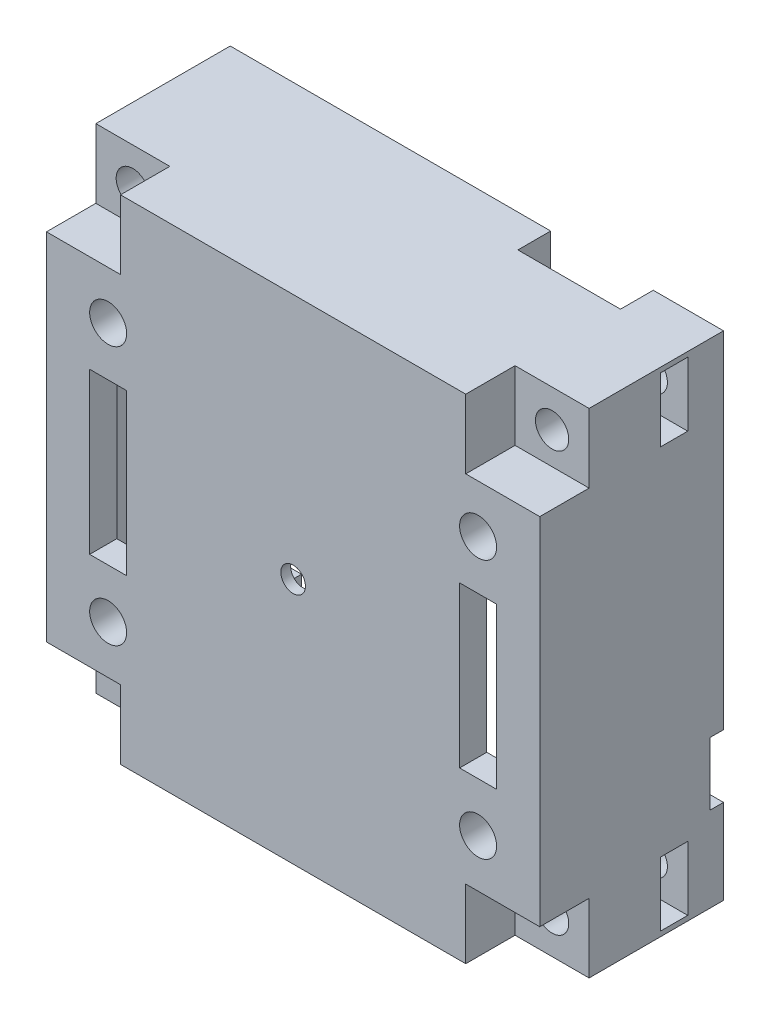
from build123d import *

# Parameters (mm, degrees)
SKETCH_1_W               = 40
SKETCH_1_H               = 40
EXTRUDE_1_DEPTH          = 12.7
CUT_EXTRUDE_2_DEPTH      = 0.7
CUT_EXTRUDE_2_DEPTH_BACK = 1.5
SKETCH_8_W               = 36.4
SKETCH_8_H               = 28.4
CUT_EXTRUDE_4_DEPTH      = 12.7
SKETCH_10_R              = 0.5
SKETCH_10_R_2            = 1.5
SKETCH_10_W              = 3
SKETCH_10_H              = 13
EXTRUDE_2_DEPTH          = 2.2
CUT_EXTRUDE_START        = -12.7
SKETCH_13_R              = 1.35
CUT_EXTRUDE_6_DEPTH      = 12.7
FILLET_1_R               = 1
SKETCH_14_W              = 8.31999735
SKETCH_14_H              = 2.64999918
CUT_EXTRUDE_8_DEPTH      = 5.8
SKETCH_15_W              = 12.8999835
SKETCH_15_H              = 7.3
CUT_EXTRUDE_9_DEPTH      = 5.8
SKETCH_16_W              = 1.085536683
SKETCH_16_H              = 5.100270408
CUT_EXTRUDE_10_DEPTH     = 1.8
SKETCH_17_W              = 8.31999735
SKETCH_17_H              = 2.65925193
CUT_EXTRUDE_11_DEPTH     = 5.8
SKETCH_23_W              = 6.0022214
SKETCH_23_H              = 5.598076211
SKETCH_23_H_2            = 5.598076212
CUT_EXTRUDE_12_DEPTH     = 4
SKETCH_24_W              = 11
SKETCH_24_H              = 14
CUT_EXTRUDE_14_DEPTH     = 1.4
SKETCH_22_W              = 1
SKETCH_22_H              = 0.8


with BuildPart() as part:
    # 草图1 → 凸台-拉伸1 (new body)
    with BuildSketch(Plane(origin=(0, 0, -12.4), x_dir=(-1, 0, 0), z_dir=(0, 0, -1))):
        with Locations((-18.22949197, 11.132690632)):
            Rectangle(SKETCH_1_W, SKETCH_1_H)
    extrude(amount=-EXTRUDE_1_DEPTH)

    # 草图2 → 切除-拉伸2 (cut, two sides: drawn at the far end of the back side and taken through both)
    with BuildSketch(Plane.XY.offset(-8).offset(-CUT_EXTRUDE_2_DEPTH_BACK)):
        Polygon((-2.01828663, -8.469233156), (2.73171337, -8.469233156), (4.23171337, -5.871156945), (2.72949197, -3.269233156), (-2.01828663, -3.269233156), align=None)
        Polygon((-2.01828663, 25.534614421), (-2.01828663, 30.734614421), (2.73171337, 30.734614421), (4.23171337, 28.13653821), (2.72949197, 25.534614421), align=None)
        Polygon((38.47727057, 30.734614421), (33.72727057, 30.734614421), (32.22727057, 28.13653821), (33.72949197, 25.534614421), (38.47727057, 25.534614421), align=None)
        Polygon((38.47727057, -3.269233156), (38.47727057, -8.469233156), (33.72727057, -8.469233156), (32.22727057, -5.871156945), (33.72949197, -3.269233156), align=None)
    extrude(amount=CUT_EXTRUDE_2_DEPTH + CUT_EXTRUDE_2_DEPTH_BACK, mode=Mode.SUBTRACT)

    # 草图8 → 切除-拉伸4 (cut)
    with BuildSketch(Plane(origin=(0, 0, -12.4), x_dir=(-1, 0, 0), z_dir=(0, 0, -1))):
        with Locations((-18.22949197, 11.132690632)):
            Rectangle(SKETCH_8_W, SKETCH_8_H)
    extrude(amount=-CUT_EXTRUDE_4_DEPTH, mode=Mode.SUBTRACT)

    # 草图13 → 切除-拉伸6 (cut)
    with BuildSketch(Plane(origin=(0, 0, -12.4), x_dir=(-1, 0, 0), z_dir=(0, 0, -1)).offset(CUT_EXTRUDE_START)):
        with Locations((-35.22949197, -5.867309368)):
            Circle(SKETCH_13_R)
        with Locations(Location((-1.22949197, -5.867309368, 0), (0, 0, 180))):
            Circle(SKETCH_13_R)
        with Locations((-1.22949197, 28.132690632)):
            Circle(SKETCH_13_R)
        with Locations(Location((-35.22949197, 28.132690632, 0), (0, 0, 180))):
            Circle(SKETCH_13_R)
    extrude(amount=CUT_EXTRUDE_6_DEPTH, mode=Mode.SUBTRACT)

    # 圆角1
    fillet_1_edges = [part.edges().sort_by_distance(p)[0] for p in [
        (0.02949197, 25.332690632, -6.05),
        (0.02949197, -3.067309368, -6.05),
        (36.42949197, -3.067309368, -6.05),
        (36.42949197, 25.332690632, -6.05),
    ]]
    fillet(fillet_1_edges, radius=FILLET_1_R)

    # 草图14 → 切除-拉伸8 (cut)
    with BuildSketch(Plane.XZ.offset(8.867309368)):
        with Locations((8.169941285, -11.07500041)):
            Rectangle(SKETCH_14_W, SKETCH_14_H)
    extrude(amount=-CUT_EXTRUDE_8_DEPTH, mode=Mode.SUBTRACT)

    # 草图15 → 切除-拉伸9 (cut)
    with BuildSketch(Plane.XZ.offset(8.867309368)):
        with Locations((23.79587104, -8.75)):
            Rectangle(SKETCH_15_W, SKETCH_15_H)
    extrude(amount=-CUT_EXTRUDE_9_DEPTH, mode=Mode.SUBTRACT)

    # 草图16 → 切除-拉伸10 (cut)
    with BuildSketch(Plane(origin=(38.22949197, 0, 0), x_dir=(0, 0, -1), z_dir=(1, 0, 0))):
        with Locations((11.857231659, 0.566559812)):
            Rectangle(SKETCH_16_W, SKETCH_16_H)
    extrude(amount=-CUT_EXTRUDE_10_DEPTH, mode=Mode.SUBTRACT)

    # 草图17 → 切除-拉伸11 (cut)
    with BuildSketch(Plane(origin=(0, 31.132690632, 0), x_dir=(1, 0, 0), z_dir=(0, 1, 0))):
        with Locations((28.372981895, 11.070374035)):
            Rectangle(SKETCH_17_W, SKETCH_17_H)
    extrude(amount=-CUT_EXTRUDE_11_DEPTH, mode=Mode.SUBTRACT)

    # 草图23 → 切除-拉伸12 (cut)
    with BuildSketch(Plane.XY.offset(2.5)):
        with Locations((35.22838127, 28.333652527)):
            Rectangle(SKETCH_23_W, SKETCH_23_H)
        with Locations((35.22838127, -6.068271262)):
            Rectangle(SKETCH_23_W, SKETCH_23_H_2)
        with Locations((1.23060267, -6.068271262)):
            Rectangle(SKETCH_23_W, SKETCH_23_H_2)
        with Locations((1.23060267, 28.333652527)):
            Rectangle(SKETCH_23_W, SKETCH_23_H)
    extrude(amount=-CUT_EXTRUDE_12_DEPTH, mode=Mode.SUBTRACT)


with BuildPart() as body_2:
    # 草图10 → 凸台-拉伸2 (new body)
    with BuildSketch(Plane.XY.offset(0.3)):
        Polygon((-1.77050803, 25.534614421), (4.23171337, 25.534614421), (4.23171337, 31.132690632), (32.22727057, 31.132690632), (32.22727057, 25.534614421), (38.22949197, 25.534614421), (38.22949197, -3.269233156), (32.22727057, -3.269233156), (32.22727057, -8.867309368), (4.23171337, -8.867309368), (4.23171337, -3.269233156), (-1.77050803, -3.269233156), align=None)
        with Locations((18.22949197, 11.132690632)):
            Circle(SKETCH_10_R, mode=Mode.SUBTRACT)
        with Locations((3.22949197, 0.632690632)):
            Circle(SKETCH_10_R_2, mode=Mode.SUBTRACT)
        with Locations((3.22949197, 21.632690632)):
            Circle(SKETCH_10_R_2, mode=Mode.SUBTRACT)
        with Locations(Location((33.22949197, 21.632690632, 0), (0, 0, 180))):
            Circle(SKETCH_10_R_2, mode=Mode.SUBTRACT)
        with Locations(Location((33.22949197, 0.632690632, 0), (0, 0, 180))):
            Circle(SKETCH_10_R_2, mode=Mode.SUBTRACT)
        with Locations((3.22949197, 11.132690632)):
            Rectangle(SKETCH_10_W, SKETCH_10_H, mode=Mode.SUBTRACT)
        with Locations((33.22949197, 11.132690632)):
            Rectangle(SKETCH_10_W, SKETCH_10_H, mode=Mode.SUBTRACT)
    extrude(amount=EXTRUDE_2_DEPTH)

    # 草图24 → 切除-拉伸14 (cut)
    with BuildSketch(Plane(origin=(0, 0, 0.3), x_dir=(-1, 0, 0), z_dir=(0, 0, -1))):
        with Locations((-18.22949197, 11.132690632)):
            Rectangle(SKETCH_24_W, SKETCH_24_H)
    extrude(amount=-CUT_EXTRUDE_14_DEPTH, mode=Mode.SUBTRACT)

    # 草图22 → 切除-旋转3 (revolve, cut)
    with BuildSketch(Plane(origin=(0, 11.132690632, 0), x_dir=(-1, 0, 0), z_dir=(0, -1, 0))):
        with Locations((-18.72949197, -2.1)):
            Rectangle(SKETCH_22_W, SKETCH_22_H)
    revolve(axis=Axis((18.22949197, 11.132690632, 5.06186702), (0, 0, -1)), mode=Mode.SUBTRACT)

    # Combine 1: union part
    add(part.part)


solid = body_2.part
